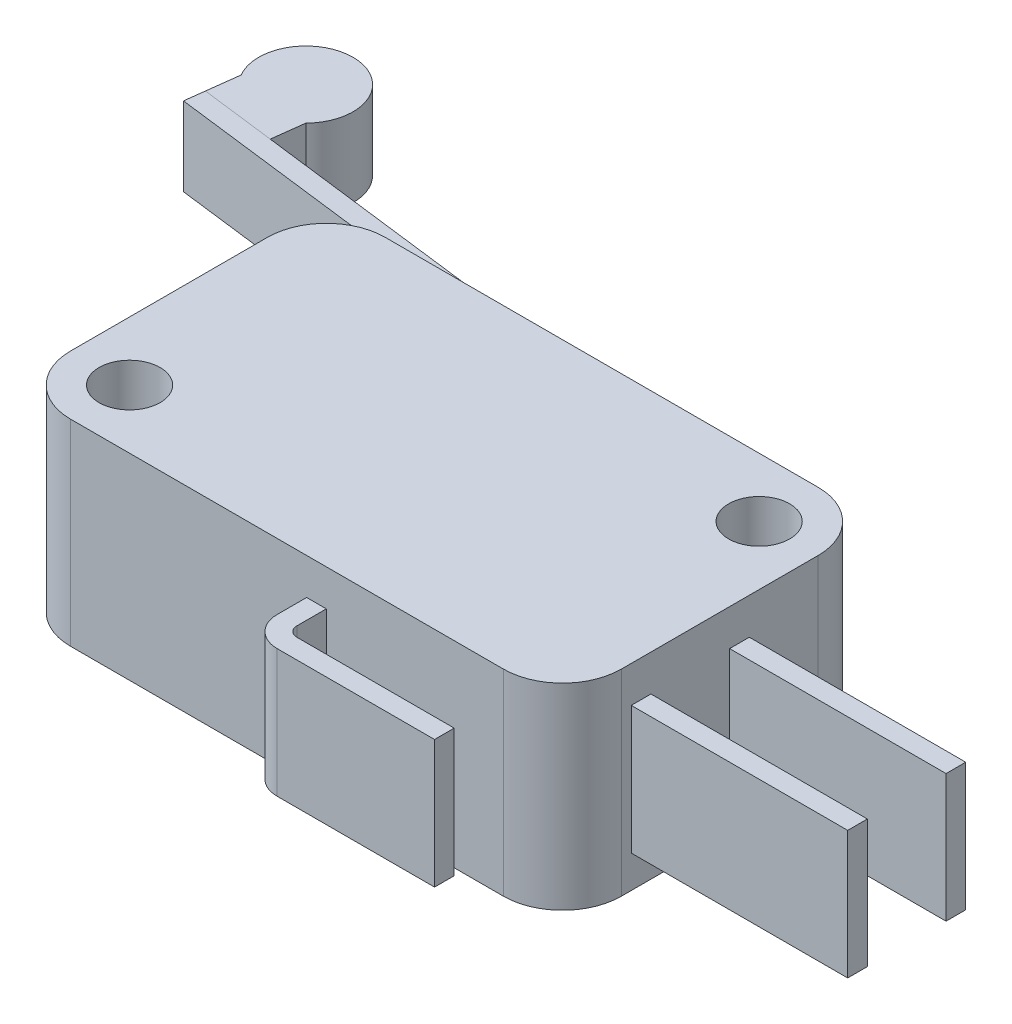
from build123d import *

# Parameters (mm, degrees)
SKETCH_1_W        = 28
SKETCH_1_H        = 16
SKETCH_1_R        = 1.55
EXTRUDE_1_DEPTH   = 10
FILLET_1_R        = 3
SKETCH_3_W        = 1
SKETCH_3_H        = 4
EXTRUDE_2_DEPTH   = 4
SKETCH_5_W        = 11
SKETCH_5_H        = 1
EXTRUDE_1_2_DEPTH = 3.25


with BuildPart() as part:
    # 草图1 → Extrude 1 (new body)
    with BuildSketch(Plane(origin=(0, 0, 0), x_dir=(1, 0, 0), z_dir=(0, 1, 0))):
        with Locations((14, 8)):
            Rectangle(SKETCH_1_W, SKETCH_1_H)
        with Locations(Location((25, 13, 0), (0, 0, 270))):
            Circle(SKETCH_1_R, mode=Mode.SUBTRACT)
        with Locations(Location((3, 3, 0), (0, 0, 270))):
            Circle(SKETCH_1_R, mode=Mode.SUBTRACT)
    extrude(amount=EXTRUDE_1_DEPTH)

    # 圆角1
    fillet_1_edges = [part.edges().sort_by_distance(p)[0] for p in [
        (0, 5, -16),
        (28, 5, -16),
        (28, 5, 0),
        (0, 5, 0),
    ]]
    fillet(fillet_1_edges, radius=FILLET_1_R)

    # 扫描1: sweep along a path in 草图2
    with BuildLine(Plane(origin=(0, 4.9, 0), x_dir=(1, 0, 0), z_dir=(0, 1, 0))) as sweep_1_path:
        Line((16.4, 13.75), (16.74133287, 16.478734482))
        ThreePointArc((16.74133287, 16.478734482), (16.538471401, 17.216727478), (15.873186829, 17.59512261))
        Line((15.873186829, 17.59512261), (-11.116477863, 20.971214994))
    # 草图3 → 扫描1 (sweep)
    with BuildSketch(Plane(origin=(-0.012274363, 0, -15.802984175), x_dir=(-0.9922670842798479, 0, -0.12412104356139277), z_dir=(0.12412104356139277, 0, -0.9922670842798479))):
        with Locations((-16.040178167, 4.9)):
            Rectangle(SKETCH_3_W, SKETCH_3_H)
    sweep(path=sweep_1_path.line)

    # 草图5 → Extrude 1 2 (add, symmetric)
    with BuildSketch(Plane(origin=(0, 4.9, 0), x_dir=(1, 0, 0), z_dir=(0, 1, 0))):
        with BuildLine():
            Line((15, 0), (15, -1.5))
            ThreePointArc((15, -1.5), (15.439339828, -2.560660172), (16.5, -3))
            Line((16.5, -3), (24.5, -3))
            Line((24.5, -3), (24.5, -2))
            Line((24.5, -2), (16.5, -2))
            ThreePointArc((16.5, -2), (16.146446609, -1.853553391), (16, -1.5))
            Line((16, -1.5), (16, 0))
            Line((16, 0), (15, 0))
        make_face()
        with Locations((33.5, 4)):
            Rectangle(SKETCH_5_W, SKETCH_5_H)
        with Locations((33.5, 9)):
            Rectangle(SKETCH_5_W, SKETCH_5_H)
    extrude(amount=EXTRUDE_1_2_DEPTH, both=True)


with BuildPart() as body_2:
    # 草图4 → 凸台-拉伸2 (new body)
    with BuildSketch(Plane(origin=(0, 6.9, 0), x_dir=(1, 0, 0), z_dir=(0, 1, 0))):
        with BuildLine():
            Line((-11.116477863, 20.971214994), (-10.914475147, 22.586095442))
            ThreePointArc((-10.914475147, 22.586095442), (-8.552109495, 26.191441002), (-7.150610771, 22.115279891))
            Line((-7.150610771, 22.115279891), (-7.352613487, 20.500399443))
            Line((-7.352613487, 20.500399443), (-11.116477863, 20.971214994))
        make_face()
    extrude(amount=-EXTRUDE_2_DEPTH)


solid = Compound([part.part, body_2.part])
